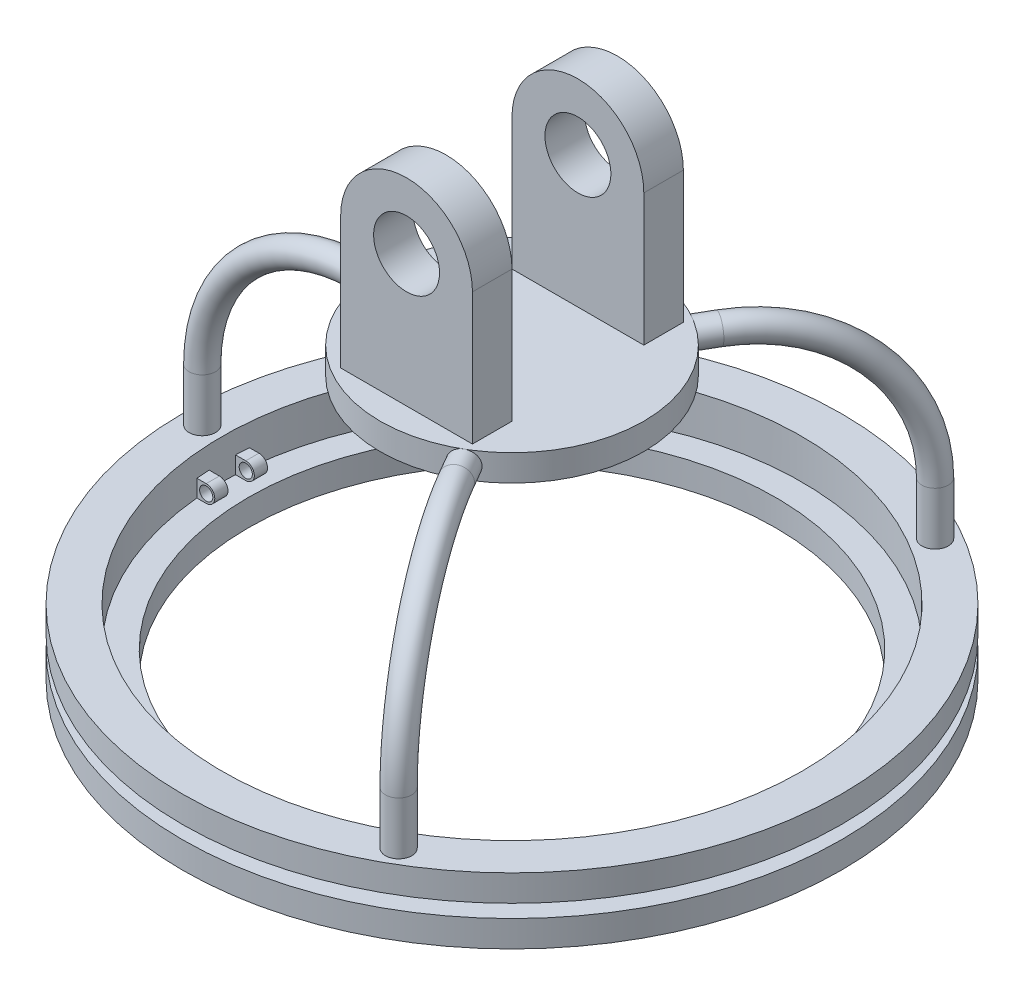
from build123d import *
from build123d.topology import SkipClean

# Parameters (mm, degrees)
SKETCH2_R           = 25.4
CUT_EXTRUDE1_DEPTH  = 2.54
SKETCH3_R           = 12.7
BOSS_EXTRUDE1_DEPTH = 2.54
SKETCH5_W           = 12.7
SKETCH5_H           = 3.81
BOSS_EXTRUDE2_DEPTH = 12.7
BOSS_EXTRUDE3_DEPTH = 3.81
CUT_EXTRUDE2_REACH  = 72.516
SKETCH10_R          = 3.175
SWEEP1_PROFILE_R    = 1.27
CIRPATTERN2_COUNT   = 3
CIRPATTERN2_ANGLE   = 240
SKETCH21_R          = 0.635
BOSS_EXTRUDE5_DEPTH = 2.54
CUT_EXTRUDE4_REACH  = 65.182


with BuildPart() as part:
    # Sketch1 → Revolve1 (revolve)
    with BuildSketch(Plane.XY):
        Polygon((31.75, 6.35), (31.75, 3.81), (29.21, 3.81), (29.21, 2.54), (31.75, 2.54), (31.75, 0), (0, 0), (0, 2.54), (27.94, 2.54), (27.94, 6.35), align=None)
    revolve(axis=Axis((0, -571.377028706, 0), (0, 1, 0)))

    # Sketch2 → Cut-Extrude1 (cut)
    with BuildSketch(Plane(origin=(0, 2.54, 0), x_dir=(1, 0, 0), z_dir=(0, 1, 0))):
        with Locations(Location((0, 0, 0), (0, 0, 180))):
            Circle(SKETCH2_R)
    extrude(amount=-CUT_EXTRUDE1_DEPTH, mode=Mode.SUBTRACT)

    # Sweep1: sweep along a path in Sketch12
    with BuildLine(Plane(origin=(0, 0, 0), x_dir=(-0.5000000000000042, 0, -0.8660254037844363), z_dir=(0.8660254037844363, 0, -0.5000000000000042))) as sweep1_path:
        Line((-29.845, 6.35), (-29.845, 11.43))
        ThreePointArc((-29.845, 11.43), (-25.381307345, 22.206307345), (-14.605, 26.67))
        Line((-14.605, 26.67), (-11.973818102, 26.67))
    # Sweep1 profile (on start of the path) → Sweep1 (sweep)
    with BuildSketch(Plane(origin=(14.9225, 6.35, 25.846528176), x_dir=(0, 0, 1), z_dir=(0, 1, 0))):
        Circle(SWEEP1_PROFILE_R)
    sweep1 = sweep(path=sweep1_path.line)

    # CirPattern2: Sweep1 ×3 about axis
    cirpattern2_axis = Axis((0, 0, 0), (0, 1, 0))
    for i in range(1, CIRPATTERN2_COUNT):
        add(sweep1.rotate(cirpattern2_axis, i * CIRPATTERN2_ANGLE / (CIRPATTERN2_COUNT - 1)))

    # Sketch21 → Boss-Extrude5 (add, symmetric)
    with BuildSketch(Plane.XY):
        with BuildLine():
            Line((-28.194, 2.54), (-28.194, 4.191))
            Line((-28.194, 4.191), (-26.924, 4.191))
            ThreePointArc((-26.924, 4.191), (-26.0985, 3.3655), (-26.924, 2.54))
            Line((-26.924, 2.54), (-28.194, 2.54))
        make_face()
        with Locations((-26.924, 3.3655)):
            Circle(SKETCH21_R, mode=Mode.SUBTRACT)
    extrude(amount=BOSS_EXTRUDE5_DEPTH, both=True)

    # Cut-Extrude4: up to this face of the body (flat: up to its plane)
    cut_extrude4_end = Plane(part.part.faces().sort_by_distance((-27.413341897, 4.191, 0))[0])
    # Sketch23 → Cut-Extrude4 (cut, up to the picked face)
    with BuildSketch(Plane(origin=(0, 2.54, 0), x_dir=(1, 0, 0), z_dir=(0, 1, 0)), mode=Mode.PRIVATE) as cut_extrude4_sk1:
        with BuildLine():
            Line((-26.0985, -1.27), (-27.911121439, -1.27))
            ThreePointArc((-27.911121439, -1.27), (-27.94, 0), (-27.911121439, 1.27))
            Line((-27.911121439, 1.27), (-26.0985, 1.27))
            Line((-26.0985, 1.27), (-26.0985, -1.27))
        make_face()
    cut_extrude4_tool1 = split(extrude(cut_extrude4_sk1.sketch, amount=CUT_EXTRUDE4_REACH, mode=Mode.PRIVATE), bisect_by=cut_extrude4_end, keep=Keep.BOTH, mode=Mode.PRIVATE)
    add(cut_extrude4_tool1.solids().sort_by(Axis((-27.014458, 2.54, 0), (0, 1, 0)))[0], mode=Mode.SUBTRACT)


with BuildPart() as body_2:
    # Sketch3 → Boss-Extrude1 (new body)
    with BuildSketch(Plane(origin=(0, 25.4, 0), x_dir=(1, 0, 0), z_dir=(0, 1, 0))):
        with Locations(Location((0, 0, 0), (0, 0, 270))):
            Circle(SKETCH3_R)
    extrude(amount=BOSS_EXTRUDE1_DEPTH)

    # Sketch5 → Boss-Extrude2 (add)
    with BuildSketch(Plane(origin=(0, 27.94, 0), x_dir=(1, 0, 0), z_dir=(0, 1, 0))):
        with Locations((0, 8.255)):
            Rectangle(SKETCH5_W, SKETCH5_H)
    boss_extrude2 = extrude(amount=BOSS_EXTRUDE2_DEPTH)

    # Sketch6 → Boss-Extrude3 (add)
    with BuildSketch(Plane.XY.offset(-6.35)):
        with BuildLine():
            Line((-6.35, 40.64), (6.35, 40.64))
            ThreePointArc((6.35, 40.64), (0, 46.99), (-6.35, 40.64))
        make_face()
    boss_extrude3 = extrude(amount=-BOSS_EXTRUDE3_DEPTH)

    # Mirror1: Boss-Extrude2, Boss-Extrude3 across plane
    add(boss_extrude2.mirror(Plane.XY))
    add(boss_extrude3.mirror(Plane.XY))

    # Cut-Extrude2: up to this face of the body (flat: up to its plane)
    cut_extrude2_end = Plane(body_2.part.faces().sort_by_distance((0, 36.840423526, 10.16))[0])
    # Sketch10 → Cut-Extrude2 (cut, up to the picked face)
    with BuildSketch(Plane(origin=(0, 0, -10.16), x_dir=(-1, 0, 0), z_dir=(0, 0, -1)), mode=Mode.PRIVATE) as cut_extrude2_sk1:
        with Locations((0, 40.64)):
            Circle(SKETCH10_R)
    cut_extrude2_tool1 = split(extrude(cut_extrude2_sk1.sketch, amount=-CUT_EXTRUDE2_REACH, mode=Mode.PRIVATE), bisect_by=cut_extrude2_end, keep=Keep.BOTH, mode=Mode.PRIVATE)
    add(cut_extrude2_tool1.solids().sort_by(Axis((0, 40.64, -10.16), (0, 0, 1)))[0], mode=Mode.SUBTRACT)


solid = Compound([part.part, body_2.part])
